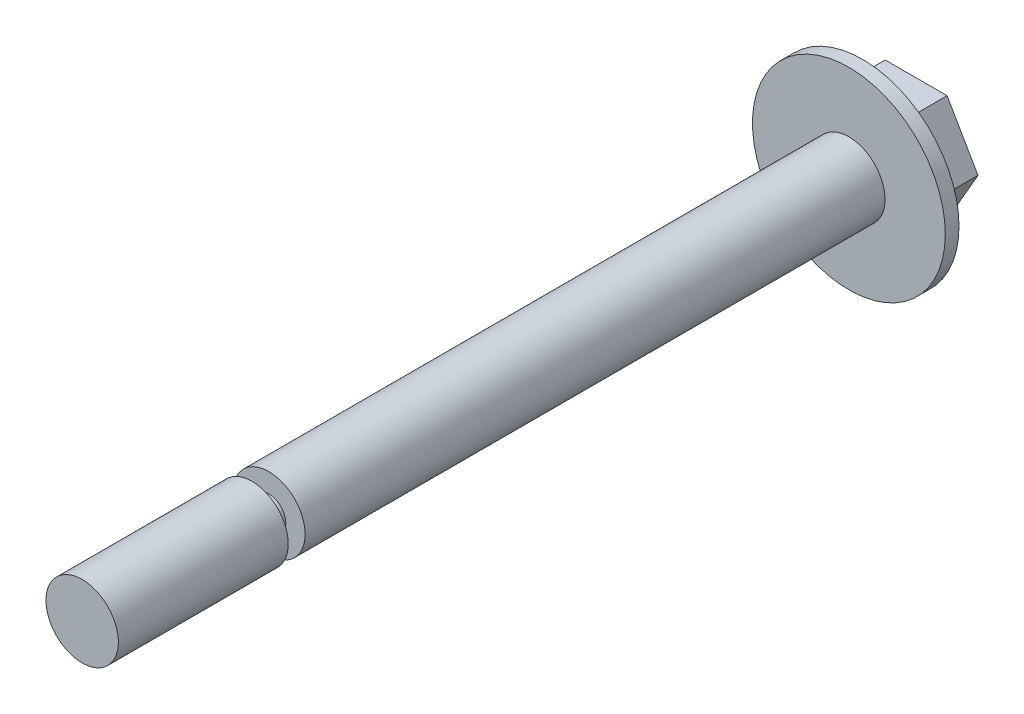
from build123d import *

# Parameters (mm, degrees)
BOSS_EXTRUDE1_DEPTH = 3.175
SKETCH2_R           = 5.715
BOSS_EXTRUDE2_DEPTH = 0.8128


with BuildPart() as part:
    # Sketch1 → Boss-Extrude1 (new body)
    with BuildSketch(Plane.XY):
        Polygon((3.666174209, 0), (1.833087105, 3.175), (-1.833087105, 3.175), (-3.666174209, 0), (-1.833087105, -3.175), (1.833087105, -3.175), align=None)
    extrude(amount=BOSS_EXTRUDE1_DEPTH)

    # Sketch2 → Boss-Extrude2 (add)
    with BuildSketch(Plane.XY.offset(3.175)):
        Circle(SKETCH2_R)
    extrude(amount=BOSS_EXTRUDE2_DEPTH)

    # Sketch3 → Revolve1 (revolve)
    with BuildSketch(Plane(origin=(0, 0, 0), x_dir=(0, 0, -1), z_dir=(1, 0, 0)), mode=Mode.PRIVATE) as revolve1_sk:
        Polygon((-3.9878, 0), (-49.4378, 0), (-49.4378, 2.145), (-39.3678, 2.145), (-39.3678, 1), (-38.3678, 1), (-38.3678, 2.145), (-3.9878, 2.145), align=None)
    revolve(revolve1_sk.sketch.rotate(Axis((0, 0, 3.9878), (0, 0, 1)), 90), axis=Axis((0, 0, 3.9878), (0, 0, 1)))


solid = part.part
